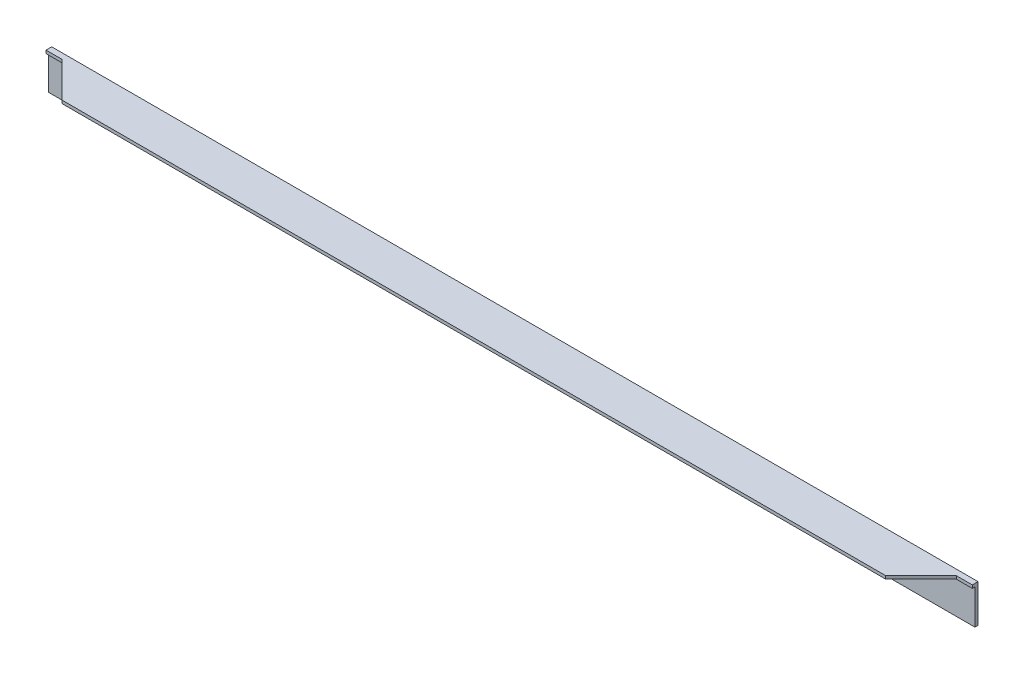
from build123d import *

# Parameters (mm, degrees)
SKETCH_1_W          = 2440
SKETCH_1_H          = 100
EXTRUDE_715_DEPTH   = 8
SKETCH_2_W          = 2440
SKETCH_2_H          = 8
EXTRUDE_1_DEPTH     = 100
CUT_EXTRUDE_1_DEPTH = 1229.846613699


with BuildPart() as part:
    # 草图1 → Extrude 715 (new body)
    with BuildSketch(Plane.XY):
        with Locations((0, 50)):
            Rectangle(SKETCH_1_W, SKETCH_1_H)
    extrude(amount=EXTRUDE_715_DEPTH)

    # 草图2 → 凸台-拉伸1 (add)
    with BuildSketch(Plane.XY.offset(8)):
        with Locations((0, 96)):
            Rectangle(SKETCH_2_W, SKETCH_2_H)
    extrude(amount=EXTRUDE_1_DEPTH)

    # 草图3 → 切除-拉伸1 (cut, through all)
    with BuildSketch(Plane(origin=(0, 100, 0), x_dir=(-1, 0, 0), z_dir=(0, 1, 0))):
        Polygon((-1085, 108), (-1178, 15), (-1220, 15), (-1220, 108), align=None)
        Polygon((1220, 15), (1178, 15), (1085, 108), (1220, 108), align=None)
    extrude(amount=-CUT_EXTRUDE_1_DEPTH, mode=Mode.SUBTRACT)


solid = part.part
